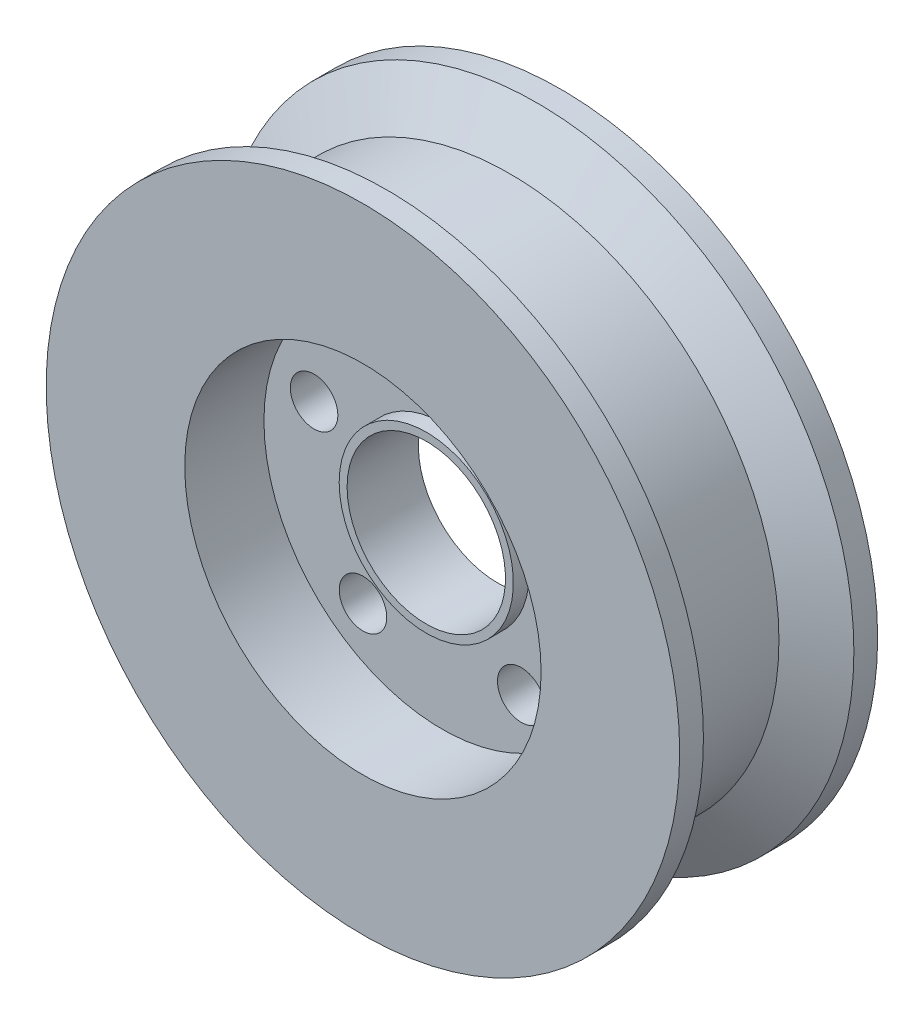
from build123d import *

# Parameters (mm, degrees)
SKETCH1_R                = 40
SKETCH1_R_2              = 10
BOSS_EXTRUDE1_DEPTH      = 12.5
SKETCH2_R                = 22.5
CUT_EXTRUDE1_DEPTH       = 10
SKETCH3_R                = 3
CUT_EXTRUDE2_DEPTH       = 59.523499554
CIRPATTERN1_COUNT        = 5
BOSS_EXTRUDE2_DEPTH      = 2
BOSS_EXTRUDE2_DEPTH_BACK = 7
SKETCH4_R                = 11
SKETCH4_R_2              = 10


with BuildPart() as part:
    # Sketch1 → Boss-Extrude1 (new, symmetric)
    with BuildSketch(Plane.XY):
        Circle(SKETCH1_R)
        Circle(SKETCH1_R_2, mode=Mode.SUBTRACT)
    extrude(amount=BOSS_EXTRUDE1_DEPTH, both=True)

    # Sketch2 → Cut-Extrude1 (cut)
    with BuildSketch(Plane.XY.offset(12.5)):
        Circle(SKETCH2_R)
    cut_extrude1 = extrude(amount=-CUT_EXTRUDE1_DEPTH, mode=Mode.SUBTRACT)

    # Mirror1: Cut-Extrude1 across plane
    add(cut_extrude1.mirror(Plane.XY), mode=Mode.SUBTRACT)

    # Sketch3 → Cut-Extrude2 (cut, through all)
    with BuildSketch(Plane.XY.offset(2.5)):
        with Locations((0, 17)):
            Circle(SKETCH3_R)
    cut_extrude2 = extrude(amount=-CUT_EXTRUDE2_DEPTH, mode=Mode.SUBTRACT)

    # CirPattern1: Cut-Extrude2 ×5 about axis
    cirpattern1_axis = Axis((0, 0, 0), (0, 0, 1))
    for i in range(1, CIRPATTERN1_COUNT):
        add(cut_extrude2.rotate(cirpattern1_axis, i * 360 / CIRPATTERN1_COUNT), mode=Mode.SUBTRACT)

    # Sketch4 → Boss-Extrude2 (add, two sides: drawn at the far end of the back side and taken through both)
    with BuildSketch(Plane(origin=(0, 0, -2.5), x_dir=(-1, 0, 0), z_dir=(0, 0, -1)).offset(-BOSS_EXTRUDE2_DEPTH_BACK)):
        Circle(SKETCH4_R)
        Circle(SKETCH4_R_2, mode=Mode.SUBTRACT)
    extrude(amount=BOSS_EXTRUDE2_DEPTH + BOSS_EXTRUDE2_DEPTH_BACK)

    # Sketch5 → Cut-Revolve1 (revolve, cut)
    with BuildSketch(Plane(origin=(0, 0, 0), x_dir=(1, 0, 0), z_dir=(0, 1, 0)), mode=Mode.PRIVATE) as cut_revolve1_sk:
        Polygon((-40, 9.5), (-34, 6.035898385), (-34, -6.035898385), (-40, -9.5), align=None)
    revolve(cut_revolve1_sk.sketch.rotate(Axis((0, 0, 0), (0, 0, -1)), 180), axis=Axis((0, 0, 0), (0, 0, -1)), mode=Mode.SUBTRACT)


solid = part.part
